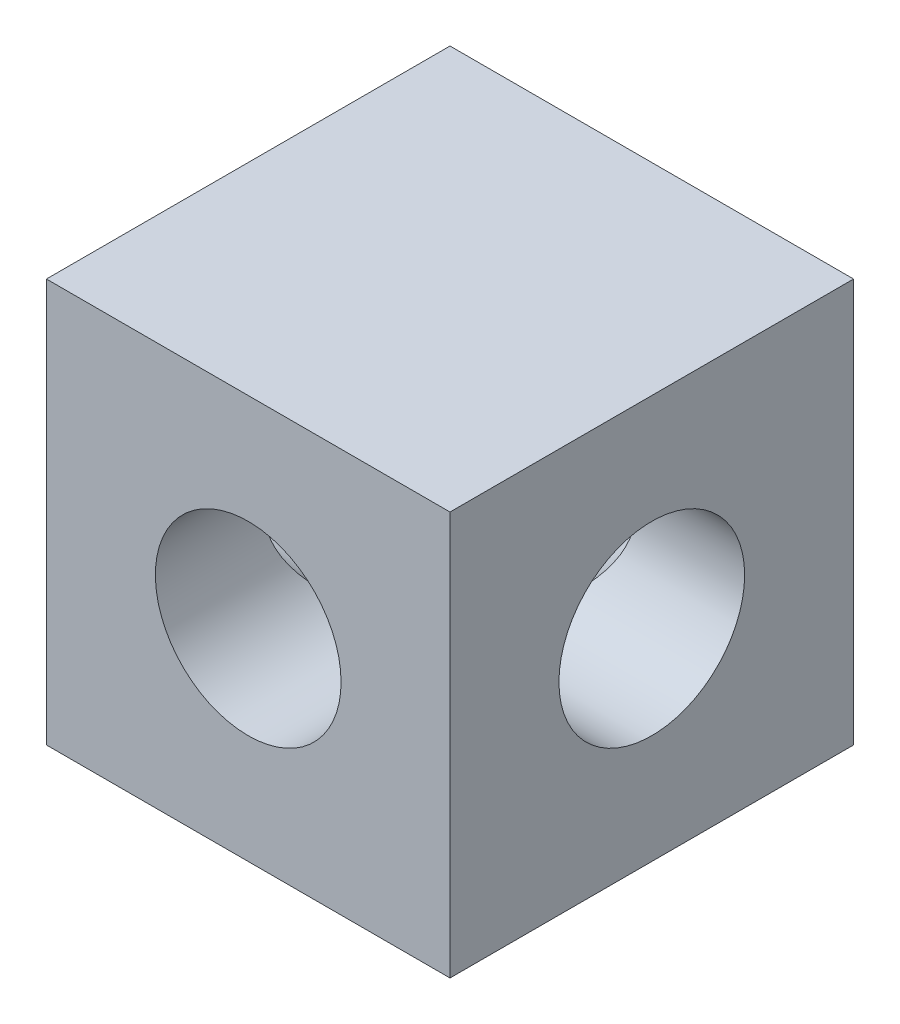
from build123d import *

# Parameters (mm, degrees)
SKETCH1_W           = 20.32
SKETCH1_H           = 20.32
SKETCH1_R           = 4.675
BOSS_EXTRUDE1_DEPTH = 20.32
SKETCH2_R           = 4.675
CUT_EXTRUDE1_DEPTH  = 31.48


with BuildPart() as part:
    # Sketch1 → Boss-Extrude1 (new body)
    with BuildSketch(Plane.XY):
        Rectangle(SKETCH1_W, SKETCH1_H)
        Circle(SKETCH1_R, mode=Mode.SUBTRACT)
    extrude(amount=BOSS_EXTRUDE1_DEPTH)

    # Sketch2 → Cut-Extrude1 (cut, through all)
    with BuildSketch(Plane(origin=(10.16, 0, 0), x_dir=(0, 0, -1), z_dir=(1, 0, 0))):
        with Locations((-10.16, 0)):
            Circle(SKETCH2_R)
    extrude(amount=-CUT_EXTRUDE1_DEPTH, mode=Mode.SUBTRACT)


solid = part.part
